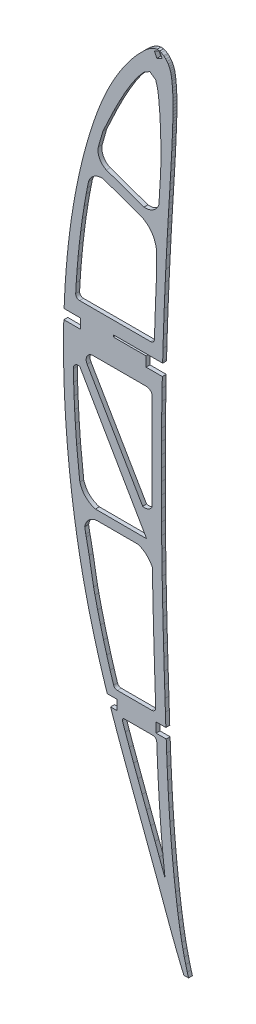
from build123d import *

# Parameters (mm, degrees)
EXTRUDE_1_DEPTH = 2


with BuildPart() as part:
    # Model → 凸台-拉伸1 (new body)
    with BuildSketch(Plane.XY):
        Polygon((88.284439893, 4.098165986), (87.35627404, 6.245757123), (86.133848746, 9.186234364), (84.935963464, 12.137792571), (83.784649269, 15.054348866), (82.659004992, 17.979032604), (81.552037296, 20.911538447), (80.459880846, 23.848694773), (79.37749678, 26.791282535), (78.300064337, 29.735087442), (77.222544655, 32.680890445), (75.055865666, 38.563980633), (72.874506291, 44.439423193), (70.681420053, 50.308348031), (68.479473239, 56.17388315), (66.272574803, 62.038201123), (64.062679223, 67.902388239), (61.853651833, 73.769616118), (59.661830557, 79.609568558), (57.486862243, 85.453259671), (55.338519275, 91.306120894), (53.229658423, 97.171716423), (50.671643268, 104.525037797), (53.98704202, 104.525037797), (53.98704202, 109.525037797), (48.98704202, 109.525037797), (47.244035659, 114.891492526), (45.438069291, 120.720265079), (43.714151538, 126.572639006), (42.073237829, 132.449656974), (40.517457117, 138.348409077), (39.046809404, 144.268895316), (37.663249166, 150.212201977), (36.36786269, 156.176374583), (35.181040305, 162.061207175), (34.079699874, 167.959781516), (33.059801584, 173.872922177), (32.119434577, 179.798543823), (31.256600757, 185.736559215), (30.468302979, 191.686837495), (29.752630385, 197.647293328), (29.110285084, 203.578920214), (28.538784968, 209.515642173), (28.037087369, 215.458414634), (27.606278574, 221.405283119), (27.248313061, 227.357333916), (26.962191781, 233.314523406), (26.750955498, 239.275983398), (26.61230078, 245.24861999), (26.550747253, 251.220619083), (26.565295869, 257.191937056), (26.659986439, 263.16174934), (26.699905268, 264.525037797), (35.173108467, 264.525037797), (35.173108467, 269.525037797), (34.173108467, 269.525037797), (26.851737057, 269.525037797), (27.0917043, 275.098942171), (27.432771404, 281.065498148), (27.865044639, 287.098095337), (28.388798314, 293.121674264), (29.007116812, 299.13436769), (29.726038043, 305.135438283), (30.549645438, 311.123062425), (31.481067, 317.094373828), (32.525385208, 323.047592494), (33.103633187, 326.080702164), (33.712201567, 329.107128031), (34.352089397, 332.126913713), (35.024339344, 335.139103782), (35.726909693, 338.144610046), (36.463840257, 341.142607935), (37.23213389, 344.132966592), (38.057360678, 347.194876738), (38.918077586, 350.246324985), (39.819367095, 353.285531333), (40.762271872, 356.311540351), (41.749832681, 359.323483852), (42.785090286, 362.320493643), (43.870042783, 365.302656965), (44.452428946, 366.842525907), (45.050062548, 368.37705485), (45.663030829, 369.904245698), (46.291290169, 371.4250975), (46.936925903, 372.937699397), (47.600980699, 374.44109596), (48.282455508, 375.935243572), (49.018258903, 377.491820381), (49.775522124, 379.038323667), (50.55433241, 380.572755334), (51.357556047, 382.098243383), (52.185236654, 383.613788768), (53.037286993, 385.121389584), (53.915705161, 386.621133069), (54.894356117, 388.23235475), (55.902721001, 389.827857574), (56.936978098, 391.40347087), (57.995434647, 392.952114061), (59.077266077, 394.469747336), (60.179824199, 395.94824745), (61.300286345, 397.383487353), (61.998469935, 398.24275953), (62.708210108, 399.089523894), (63.436282104, 399.929081021), (64.189286685, 400.77072768), (64.971089188, 401.617635495), (65.790288471, 402.479188473), (66.651748918, 403.358601857), (67.853311003, 404.541138772), (69.121163423, 405.695540453), (70.438553049, 406.747004942), (71.789638561, 407.622772001), (73.15662416, 408.248995101), (74.524667575, 408.552957621), (75.87501758, 408.459770368), (76.702244656, 408.17458207), (77.907921452, 407.424211196), (78.268386704, 407.150921929), (78.982186218, 406.460400203), (79.635623435, 405.685164882), (80.213708435, 404.847583403), (80.706359299, 403.972239398), (81.065164529, 403.182138262), (81.355297149, 402.383033098), (81.587746688, 401.57540372), (81.77241639, 400.761684419), (81.91825407, 399.943266817), (82.036292877, 399.119631679), (82.136436054, 398.293213296), (82.290038898, 396.815506909), (82.417797345, 395.333669273), (82.520754065, 393.84674496), (82.600819914, 392.356819304), (82.658950322, 390.864934973), (82.697099765, 389.372178255), (82.717266341, 387.878636388), (82.719493667, 386.383310323), (82.706648032, 384.889328064), (82.680727531, 383.39677685), (82.644772928, 381.90478849), (82.599826892, 380.412407555), (82.548842947, 378.920763953), (82.493862808, 377.428945873), (82.436016384, 375.93399979), (82.377127291, 374.440009135), (82.315241054, 372.945887623), (82.251356721, 371.451678872), (82.185430672, 369.95838193), (82.116551097, 368.463955082), (82.044674378, 366.969397376), (81.893059412, 363.976935864), (81.730367677, 360.985992635), (81.560638985, 357.995743118), (81.383873336, 355.006187314), (81.204066923, 352.0174997), (81.021306984, 349.02768218), (80.838590665, 346.036865611), (80.656873394, 343.046092662), (80.477110601, 340.056406), (80.299389523, 337.065807528), (80.12462197, 334.076338963), (79.952895182, 331.086002208), (79.784165538, 328.095796311), (79.619519325, 325.103766795), (79.302909192, 319.127268152), (79.001284782, 313.1514238), (78.71764324, 307.176364598), (78.451072757, 301.200048828), (78.202528761, 295.223519159), (77.973141158, 289.243822066), (77.761823663, 283.262912025), (77.571137225, 277.290910377), (77.399389083, 271.320736546), (77.37916795, 270.525037797), (52.103754898, 270.525037797), (52.103754898, 269.525037797), (68.890222267, 269.525037797), (68.890222267, 264.525037797), (77.229320454, 264.525037797), (77.114967504, 259.379965283), (77.001295018, 253.409324231), (76.907734355, 247.436558423), (76.833242846, 241.462623286), (76.778470585, 235.495554827), (76.741681193, 229.529271516), (76.722831049, 223.564772403), (76.722007393, 217.600059391), (76.737212127, 211.63504524), (76.767446204, 205.669686332), (76.813795911, 199.70202819), (76.875000483, 193.738021483), (76.949105443, 187.776579924), (77.038196126, 181.815792657), (77.140230817, 175.856571489), (77.256339422, 169.895962897), (77.385435654, 163.935921357), (77.52765037, 157.973449724), (77.681766427, 152.01349962), (77.847827443, 146.055071997), (78.023791702, 140.099078664), (78.207791967, 134.142435238), (78.399784617, 128.186140767), (78.597815176, 122.229108965), (78.799972786, 116.269254495), (79.035705319, 109.525037797), (74.035705319, 109.525037797), (74.035705319, 104.525037797), (79.217884882, 104.525037797), (79.457135359, 98.397909964), (79.713067095, 92.444407134), (79.997927611, 86.493168314), (80.319840149, 80.541545316), (80.684711761, 74.591797951), (81.098885691, 68.63619555), (81.565878319, 62.685902121), (82.088686788, 56.741048523), (82.671350913, 50.800810185), (83.316824217, 44.866317012), (84.030145561, 38.936788055), (84.812313994, 33.012266931), (85.234719759, 30.03185532), (85.681970872, 27.055531339), (86.160018002, 24.084555751), (86.673725532, 21.122143799), (87.230130419, 18.16760177), (87.836095143, 15.224232145), (88.495572278, 12.293208448), (89.228031947, 9.318326462), (90.013960406, 6.356789453), (90.682983048, 4.098165986), align=None)
        with BuildLine():
            Line((76.383873336, 355.006187314), (76.204066923, 352.0174997))
            Line((76.204066923, 352.0174997), (76.021306984, 349.02768218))
            Line((76.021306984, 349.02768218), (75.838590665, 346.036865611))
            Line((75.838590665, 346.036865611), (75.656873394, 343.046092662))
            Line((75.656873394, 343.046092662), (75.477110601, 340.056406))
            ThreePointArc((75.477110601, 340.056406), (72.557444403, 336.213324306), (67.859062782, 335.109269163))
            Line((67.859062782, 335.109269163), (48.484285825, 341.939171681))
            ThreePointArc((48.484285825, 341.939171681), (44.969239445, 345.328023568), (44.417239465, 350.179328978))
            Line((44.417239465, 350.179328978), (46.571122116, 357.715519073))
            Line((46.571122116, 357.715519073), (46.720280305, 358.237406586))
            Line((46.720280305, 358.237406586), (48.491122116, 362.010519073))
            Line((48.491122116, 362.010519073), (52.177580154, 369.865213241))
            Line((52.177580154, 369.865213241), (55.414765952, 376.206593045))
            Line((55.414765952, 376.206593045), (58.379238142, 381.636543197))
            Line((58.379238142, 381.636543197), (61.653622116, 386.988467349))
            Line((61.653622116, 386.988467349), (64.561122116, 391.232519073))
            Line((64.561122116, 391.232519073), (67.731122116, 394.948519073))
            Line((67.731122116, 394.948519073), (70.841122116, 396.761519073))
            Line((70.841122116, 396.761519073), (73.861273802, 394.571910646))
            Line((73.861273802, 394.571910646), (74.80445545, 391.06418574))
            Line((74.80445545, 391.06418574), (75.291122116, 387.939519073))
            Line((75.291122116, 387.939519073), (76.051122116, 379.403519073))
            Line((76.051122116, 379.403519073), (76.261122116, 373.787519073))
            Line((76.261122116, 373.787519073), (76.554453782, 365.942992233))
            Line((76.554453782, 365.942992233), (76.383873336, 355.006187314))
        make_face(mode=Mode.SUBTRACT)
        with BuildLine():
            Line((74.181122116, 316.688519073), (74.35753107, 310.19615028))
            Line((74.35753107, 310.19615028), (74.090960587, 304.21983451))
            Line((74.090960587, 304.21983451), (73.842416591, 298.243304841))
            Line((73.842416591, 298.243304841), (73.613028988, 292.263607748))
            Line((73.613028988, 292.263607748), (73.401711493, 286.282697707))
            Line((73.401711493, 286.282697707), (73.211025055, 280.310696059))
            Line((73.211025055, 280.310696059), (73.172954342, 278.987311881))
            ThreePointArc((73.172954342, 278.987311881), (72.567513235, 277.610420607), (71.173781409, 277.044823479))
            Line((71.173781409, 277.044823479), (34.787795629, 277.044823479))
            ThreePointArc((34.787795629, 277.044823479), (33.33378739, 277.671557284), (32.791055268, 279.158963437))
            Line((32.791055268, 279.158963437), (33.072659234, 284.08528383))
            Line((33.072659234, 284.08528383), (33.504932469, 290.117881019))
            Line((33.504932469, 290.117881019), (34.028686144, 296.141459946))
            Line((34.028686144, 296.141459946), (34.647004642, 302.154153372))
            Line((34.647004642, 302.154153372), (35.365925873, 308.155223965))
            Line((35.365925873, 308.155223965), (36.189533268, 314.142848107))
            Line((36.189533268, 314.142848107), (37.12095483, 320.11415951))
            Line((37.12095483, 320.11415951), (38.165273038, 326.067378176))
            Line((38.165273038, 326.067378176), (38.743521017, 329.100487846))
            Line((38.743521017, 329.100487846), (39.352089397, 332.126913713))
            ThreePointArc((39.352089397, 332.126913713), (42.24854207, 336.021700301), (46.966214079, 337.16291521))
            Line((46.966214079, 337.16291521), (66.701122116, 330.150519073))
            ThreePointArc((66.701122116, 330.150519073), (72.548864375, 324.590660961), (74.181122116, 316.688519073))
        make_face(mode=Mode.SUBTRACT)
        with BuildLine():
            Line((57.692615893, 102.730534273), (72.364346066, 102.730534273))
            ThreePointArc((72.364346066, 102.730534273), (73.750641059, 102.172125821), (74.362817212, 100.808720466))
            Line((74.362817212, 100.808720466), (74.457135359, 98.397909964))
            Line((74.457135359, 98.397909964), (74.713067095, 92.444407134))
            Line((74.713067095, 92.444407134), (74.997927611, 86.493168314))
            Line((74.997927611, 86.493168314), (75.319840149, 80.541545316))
            Line((75.319840149, 80.541545316), (75.684711761, 74.591797951))
            Line((75.684711761, 74.591797951), (76.098885691, 68.63619555))
            Line((76.098885691, 68.63619555), (76.565878319, 62.685902121))
            Line((76.565878319, 62.685902121), (77.088686788, 56.741048523))
            Line((77.088686788, 56.741048523), (77.671350913, 50.800810185))
            Line((77.671350913, 50.800810185), (78.604818965, 42.472342382))
            Line((78.604818965, 42.472342382), (77.874506291, 44.439423193))
            Line((77.874506291, 44.439423193), (75.681420053, 50.308348031))
            Line((75.681420053, 50.308348031), (73.479473239, 56.17388315))
            Line((73.479473239, 56.17388315), (71.272574803, 62.038201123))
            Line((71.272574803, 62.038201123), (69.062679223, 67.902388239))
            Line((69.062679223, 67.902388239), (66.853651833, 73.769616118))
            Line((66.853651833, 73.769616118), (64.661830557, 79.609568558))
            Line((64.661830557, 79.609568558), (62.486862243, 85.453259671))
            Line((62.486862243, 85.453259671), (60.338519275, 91.306120894))
            Line((60.338519275, 91.306120894), (58.229658423, 97.171716423))
            Line((58.229658423, 97.171716423), (57.2148056, 100.069460684))
            Line((57.2148056, 100.069460684), (56.748822787, 101.399997478))
            ThreePointArc((56.748822787, 101.399997478), (56.876976024, 102.309094211), (57.692615893, 102.730534273))
        make_face(mode=Mode.SUBTRACT)
        with BuildLine():
            Line((72.19828512, 172.876267193), (72.256339422, 169.895962897))
            Line((72.256339422, 169.895962897), (72.385435654, 163.935921357))
            Line((72.385435654, 163.935921357), (72.52765037, 157.973449724))
            Line((72.52765037, 157.973449724), (72.681766427, 152.01349962))
            Line((72.681766427, 152.01349962), (72.847827443, 146.055071997))
            Line((72.847827443, 146.055071997), (72.982796999, 141.486656905))
            Line((72.982796999, 141.486656905), (73.403541802, 127.956526477))
            Line((73.403541802, 127.956526477), (73.799972786, 116.269254495))
            Line((73.799972786, 116.269254495), (73.821681275, 115.644690281))
            ThreePointArc((73.821681275, 115.644690281), (73.261454825, 114.185782786), (71.822888288, 113.575216598))
            Line((71.822888288, 113.575216598), (54.125992077, 113.575216598))
            ThreePointArc((54.125992077, 113.575216598), (52.939363464, 113.965274818), (52.215589095, 114.983304063))
            Line((52.215589095, 114.983304063), (50.438069291, 120.720265079))
            Line((50.438069291, 120.720265079), (48.714151538, 126.572639006))
            Line((48.714151538, 126.572639006), (47.073237829, 132.449656974))
            Line((47.073237829, 132.449656974), (45.517457117, 138.348409077))
            Line((45.517457117, 138.348409077), (44.046809404, 144.268895316))
            Line((44.046809404, 144.268895316), (42.663249166, 150.212201977))
            Line((42.663249166, 150.212201977), (41.972638051, 153.391889248))
            Line((41.972638051, 153.391889248), (39.698192361, 166.242295095))
            Line((39.698192361, 166.242295095), (38.205139799, 173.757802101))
            Line((38.205139799, 173.757802101), (37.933239562, 174.932439171))
            Line((37.933239562, 174.932439171), (37.423991224, 177.95069714))
            ThreePointArc((37.423991224, 177.95069714), (39.525511847, 181.92571768), (43.620550338, 183.782552886))
            Line((43.620550338, 183.782552886), (64.739561561, 183.782552886))
            ThreePointArc((64.739561561, 183.782552886), (69.134104688, 181.247519166), (72.127691677, 177.151564798))
            Line((72.127691677, 177.151564798), (72.19828512, 172.876267193))
        make_face(mode=Mode.SUBTRACT)
        Polygon((75.866220781, 408.407005492), (73.140285587, 407.153909199), (74.393338261, 404.428973053), (77.118318026, 405.681026679), align=None, mode=Mode.SUBTRACT)
        with BuildLine():
            Line((33.266179656, 212.296033269), (32.606278574, 221.405283119))
            Line((32.606278574, 221.405283119), (32.248313061, 227.357333916))
            Line((32.248313061, 227.357333916), (31.962191781, 233.314523406))
            Line((31.962191781, 233.314523406), (31.750955498, 239.275983398))
            Line((31.750955498, 239.275983398), (31.61230078, 245.24861999))
            ThreePointArc((31.61230078, 245.24861999), (32.554361697, 247.421512646), (34.891892227, 247.802159838))
            Line((34.891892227, 247.802159838), (69.176745391, 188.446428819))
            Line((69.176745391, 188.446428819), (42.92468897, 188.511578326))
            ThreePointArc((42.92468897, 188.511578326), (37.830954639, 191.440624681), (34.908163333, 196.537950742))
            Line((34.908163333, 196.537950742), (33.266179656, 212.296033269))
        make_face(mode=Mode.SUBTRACT)
        with BuildLine():
            Line((42.044678231, 256.072616509), (69.050007267, 256.072616509))
            ThreePointArc((69.050007267, 256.072616509), (70.979111985, 255.370127116), (72.004766301, 253.591653168))
            Line((72.004766301, 253.591653168), (72.001295018, 253.409324231))
            Line((72.001295018, 253.409324231), (71.907734355, 247.436558423))
            Line((71.907734355, 247.436558423), (71.859225657, 243.546345764))
            Line((71.859225657, 243.546345764), (72.005822027, 204.066193342))
            ThreePointArc((72.005822027, 204.066193342), (69.982689896, 202.054041094), (67.136119377, 201.856920419))
            Line((67.136119377, 201.856920419), (38.636860937, 250.718517802))
            ThreePointArc((38.636860937, 250.718517802), (38.709038971, 254.434143414), (42.044678231, 256.072616509))
        make_face(mode=Mode.SUBTRACT)
    extrude(amount=EXTRUDE_1_DEPTH)


solid = part.part
